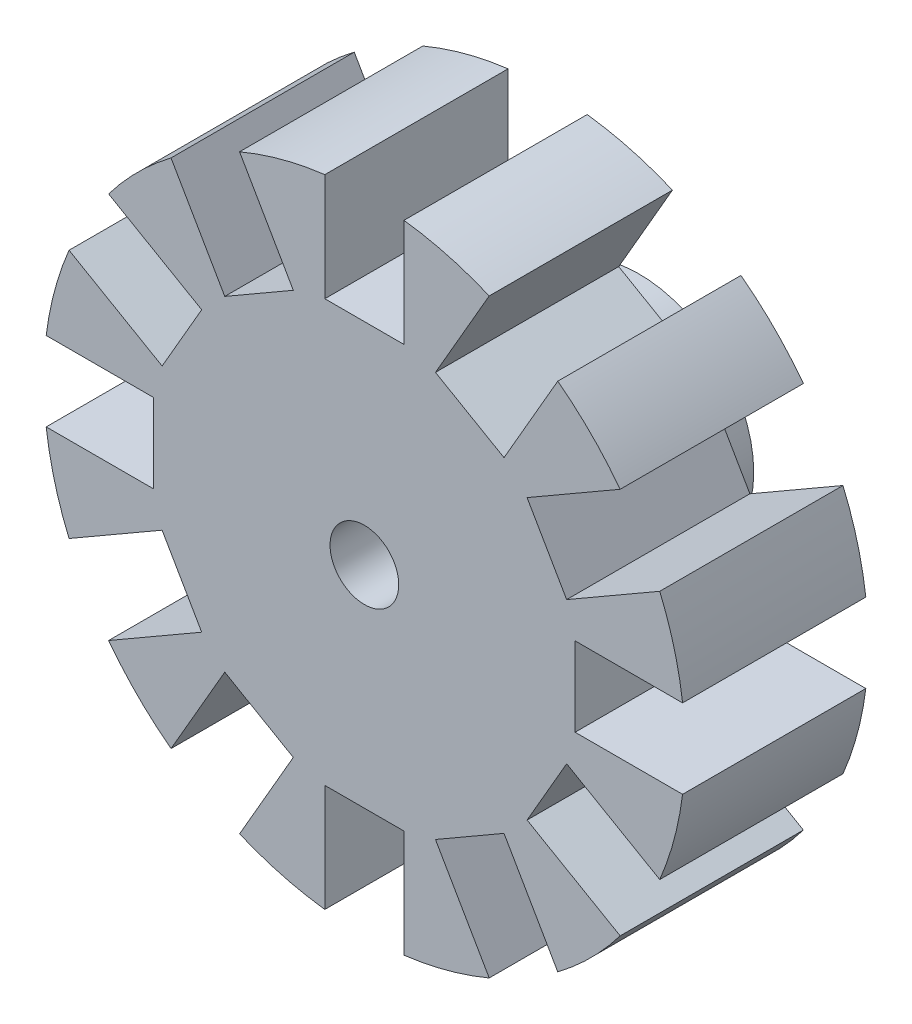
from build123d import *

# Parameters (mm, degrees)
SKETCH1_R           = 14
SKETCH1_R_2         = 1.5
BOSS_EXTRUDE1_DEPTH = 8
SKETCH2_W           = 5.1
SKETCH2_H           = 3.455751918
CUT_EXTRUDE2_DEPTH  = 9
CIRPATTERN1_COUNT   = 12
BOSS_EXTRUDE2_START = -4
SKETCH3_R           = 5
SKETCH3_R_2         = 1.5
BOSS_EXTRUDE2_DEPTH = 4


with BuildPart() as part:
    # Sketch1 → Boss-Extrude1 (new body)
    with BuildSketch(Plane.XY):
        Circle(SKETCH1_R)
        Circle(SKETCH1_R_2, mode=Mode.SUBTRACT)
    extrude(amount=BOSS_EXTRUDE1_DEPTH)

    # Sketch2 → Cut-Extrude2 (cut)
    with BuildSketch(Plane.XY):
        with Locations((11.75, 0)):
            Rectangle(SKETCH2_W, SKETCH2_H)
    cut_extrude2 = extrude(amount=CUT_EXTRUDE2_DEPTH, mode=Mode.SUBTRACT)

    # CirPattern1: Cut-Extrude2 ×12 about axis
    cirpattern1_axis = Axis((0, 0, -0.4), (0, 0, 1))
    for i in range(1, CIRPATTERN1_COUNT):
        add(cut_extrude2.rotate(cirpattern1_axis, i * 360 / CIRPATTERN1_COUNT), mode=Mode.SUBTRACT)

    # Sketch3 → Boss-Extrude2 (add)
    with BuildSketch(Plane.XY.offset(BOSS_EXTRUDE2_START)):
        Circle(SKETCH3_R)
        Circle(SKETCH3_R_2, mode=Mode.SUBTRACT)
    extrude(amount=BOSS_EXTRUDE2_DEPTH)


solid = part.part
